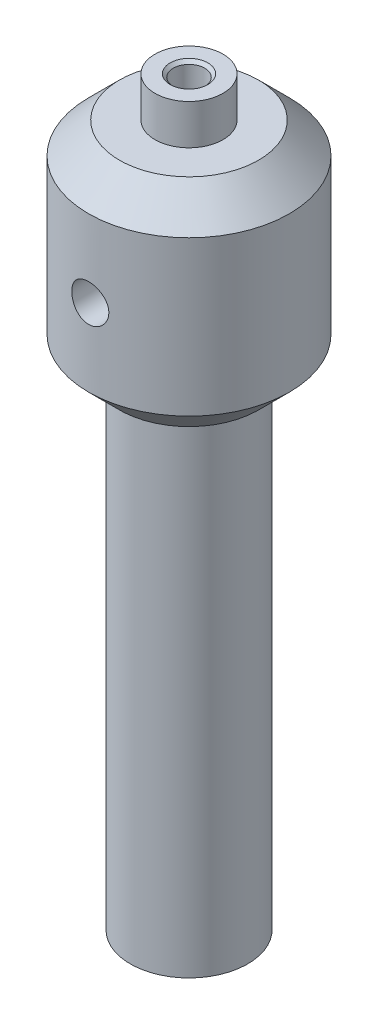
from build123d import *

# Parameters (mm, degrees)
M12_TAPPED_HOLE1_D      = 10.2
M12_TAPPED_HOLE1_DEPTH  = 35
M12_TAPPED_HOLE1_TIP    = 3.064389157
CUT_EXTRUDE1_DEPTH      = 245.361412666
CUT_EXTRUDE1_DEPTH_BACK = 245.361412666
SKETCH4_R               = 6
CHAMFER1_SIZE           = 1


with BuildPart() as part:
    # Sketch1 → Revolve1 (revolve)
    with BuildSketch(Plane.XY, mode=Mode.PRIVATE) as revolve1_sk:
        Polygon((0, 0), (0, 240), (11, 240), (11, 227), (22.5, 227), (32.5, 217), (32.5, 167), (22.5, 157), (19, 157), (19, 0), align=None)
    revolve(revolve1_sk.sketch.rotate(Axis((0, 0, 0), (0, 1, 0)), 90), axis=Axis((0, 0, 0), (0, 1, 0)))

    # M12 Tapped Hole1
    with Locations(Plane.ZX.offset(240)):
        with Locations((0, 0)):
            Hole(M12_TAPPED_HOLE1_D / 2, depth=M12_TAPPED_HOLE1_DEPTH)
            with Locations((0, 0, -(M12_TAPPED_HOLE1_DEPTH + M12_TAPPED_HOLE1_TIP / 2))):  # 118° drill point
                Cone(0, M12_TAPPED_HOLE1_D / 2, M12_TAPPED_HOLE1_TIP, mode=Mode.SUBTRACT)

    # Sketch4 → Cut-Extrude1 (cut, two sides: drawn at the far end of the back side and taken through both)
    with BuildSketch(Plane.XY.offset(-CUT_EXTRUDE1_DEPTH_BACK)):
        with Locations((0, 192)):
            Circle(SKETCH4_R)
    extrude(amount=CUT_EXTRUDE1_DEPTH + CUT_EXTRUDE1_DEPTH_BACK, mode=Mode.SUBTRACT)

    # Chamfer1
    chamfer1_edges = [part.edges().sort_by_distance(p)[0] for p in [
        (0, 240, 5.1),
    ]]
    chamfer(chamfer1_edges, length=CHAMFER1_SIZE)


solid = part.part
